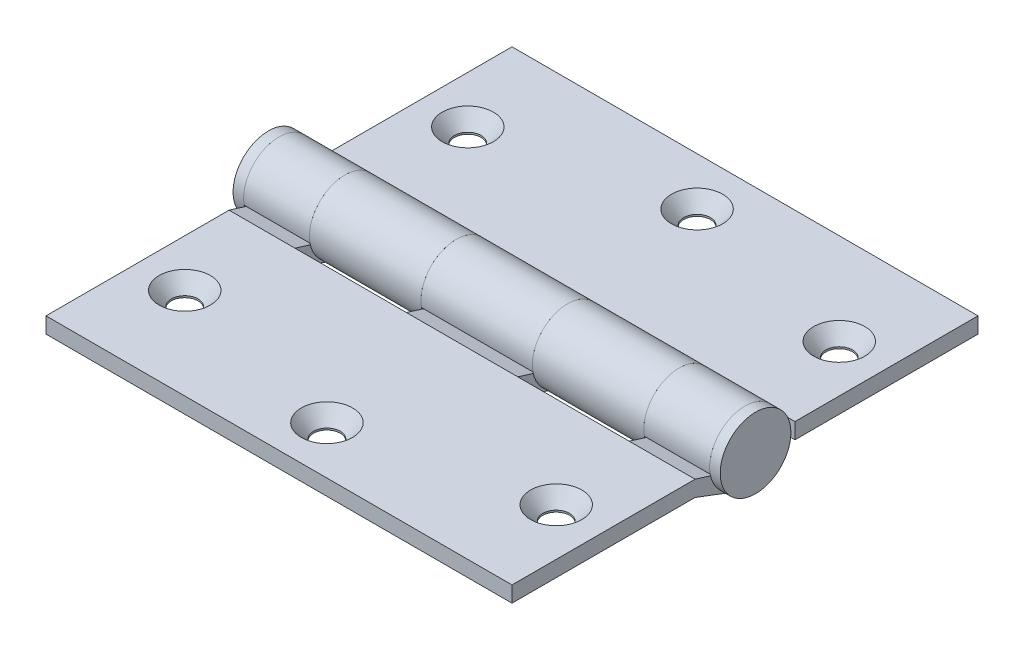
from build123d import *

# Parameters (mm, degrees)
LEFT_LEAF_DEPTH                              = 44.45
CUT_EXTRUDE1_DEPTH                           = 64.222822796
CUT_EXTRUDE1_DEPTH_BACK                      = 64.222822796
SKETCH2_W                                    = 21.2598
SKETCH2_H                                    = 16.271875
RIGHT_LEAF_DEPTH                             = 21.2598
EXTRUDE3_START                               = -44.45
SKETCH4_W                                    = 34.925
SKETCH4_H                                    = 3.0226
EXTRUDE3_DEPTH                               = 88.9
SKETCH6_W                                    = 88.9
SKETCH6_H                                    = 3.3734375
SKETCH7_W                                    = 2.015066667
SKETCH7_H                                    = 6.746875
CSK_FOR_10_FLAT_HEAD_MACHINE_SCREW1_AT_COUNT = 2
CSK_FOR_10_FLAT_HEAD_MACHINE_SCREW1_AT_PITCH = 54.0004
CSK_FOR_10_FLAT_HEAD_MACHINE_SCREW1_2_COUNT  = 2
CSK_FOR_10_FLAT_HEAD_MACHINE_SCREW1_2_PITCH  = 89.0956405
CSK_FOR_10_FLAT_HEAD_MACHINE_SCREW1_3_COUNT  = 2
CSK_FOR_10_FLAT_HEAD_MACHINE_SCREW1_3_PITCH  = 70.866
CSK_FOR_10_FLAT_HEAD_MACHINE_SCREW1_4_COUNT  = 2
CSK_FOR_10_FLAT_HEAD_MACHINE_SCREW1_4_PITCH  = 71.676774812
CSK_FOR_10_FLAT_HEAD_MACHINE_SCREW1_5_COUNT  = 2
CSK_FOR_10_FLAT_HEAD_MACHINE_SCREW1_5_PITCH  = 36.39345824


with BuildPart() as part:
    # Sketch1 → Left Leaf (new, symmetric)
    with BuildSketch(Plane(origin=(0, 0, 0), x_dir=(0, 0, -1), z_dir=(1, 0, 0))):
        with BuildLine():
            Line((-9.525, -3.6068), (-2.389867117, -6.309426078))
            ThreePointArc((-2.389867117, -6.309426078), (5.183454402, 4.318810338), (-6.637155431, -1.21181271))
            Line((-6.637155431, -1.21181271), (-2.148853245, -2.600482704))
            ThreePointArc((-2.148853245, -2.600482704), (1.603448449, 2.968001624), (-0.997099439, -3.222712099))
            Line((-0.997099439, -3.222712099), (-9.525, -0.5842))
            Line((-9.525, -0.5842), (-44.45, -0.5842))
            Line((-44.45, -0.5842), (-44.45, -3.6068))
            Line((-44.45, -3.6068), (-9.525, -3.6068))
        make_face()
    extrude(amount=LEFT_LEAF_DEPTH, both=True)

    # Sketch2 → Cut-Extrude1 (cut, two sides: drawn at the far end of the back side and taken through both)
    with BuildSketch(Plane(origin=(0, 0, 0), x_dir=(1, 0, 0), z_dir=(0, 1, 0)).offset(-CUT_EXTRUDE1_DEPTH_BACK)):
        with Locations((21.2598, -1.3890625)):
            Rectangle(SKETCH2_W, SKETCH2_H)
        with Locations((-21.2598, -1.3890625)):
            Rectangle(SKETCH2_W, SKETCH2_H)
    extrude(amount=CUT_EXTRUDE1_DEPTH + CUT_EXTRUDE1_DEPTH_BACK, mode=Mode.SUBTRACT)

    # Sketch9 → CSK for #10 Flat Head Machine Screw1 (revolve, cut)
    with BuildSketch(Plane(origin=(-35.433, -0.5842, 27.0002), x_dir=(0, 0, 1), z_dir=(1, 0, 0))):
        Polygon((0, 0), (0, 6.162675), (2.5527, 6.162675), (2.5527, 2.688180894), (4.8895, 0), align=None)
    csk_for_10_flat_head_machine_screw1 = revolve(axis=Axis((-35.433, 5.7658, 27.0002), (0, -1, 0)), mode=Mode.SUBTRACT)

    # CSK for _10 Flat Head Machine Screw1 3: CSK for #10 Flat Head Machine Screw1 ×2
    with Locations(*[(i * CSK_FOR_10_FLAT_HEAD_MACHINE_SCREW1_3_PITCH, 0, 0) for i in range(1, CSK_FOR_10_FLAT_HEAD_MACHINE_SCREW1_3_COUNT)]):
        add(csk_for_10_flat_head_machine_screw1, mode=Mode.SUBTRACT)

    # CSK for _10 Flat Head Machine Screw1 5: CSK for #10 Flat Head Machine Screw1 ×2
    with Locations(*[Vector(0.9736090416769398, 0, 0.22822233450061566) * (i * CSK_FOR_10_FLAT_HEAD_MACHINE_SCREW1_5_PITCH) for i in range(1, CSK_FOR_10_FLAT_HEAD_MACHINE_SCREW1_5_COUNT)]):
        add(csk_for_10_flat_head_machine_screw1, mode=Mode.SUBTRACT)


with BuildPart() as body_2:
    # Sketch3 → Right Leaf (new body)
    with BuildSketch(Plane(origin=(31.8897, 0, 0), x_dir=(0, 0, -1), z_dir=(1, 0, 0))):
        with BuildLine():
            Line((9.525, -3.6068), (2.389867117, -6.309426078))
            ThreePointArc((2.389867117, -6.309426078), (-5.183454402, 4.318810338), (6.637155431, -1.21181271))
            Line((6.637155431, -1.21181271), (2.148853245, -2.600482704))
            ThreePointArc((2.148853245, -2.600482704), (-1.603448449, 2.968001624), (0.997099439, -3.222712099))
            Line((0.997099439, -3.222712099), (9.525, -0.5842))
            Line((9.525, -0.5842), (44.45, -0.5842))
            Line((44.45, -0.5842), (44.45, -3.6068))
            Line((44.45, -3.6068), (9.525, -3.6068))
        make_face()
    extrude(amount=-RIGHT_LEAF_DEPTH)


with BuildPart() as body_3:
    # Mirror1: mirrored copy
    add(body_2.part.mirror(Plane(origin=(0, 0, 0), x_dir=(0, 0, 1), z_dir=(1, 0, 0))))


with BuildPart() as body_4:
    # Sketch4 → Extrude3 (new body)
    with BuildSketch(Plane.ZY.offset(EXTRUDE3_START)):
        with Locations((-26.9875, -2.0955)):
            Rectangle(SKETCH4_W, SKETCH4_H)
    extrude(amount=EXTRUDE3_DEPTH)


with BuildPart() as body_3_1:
    add(body_3.part)

    # Combine1: union body 2, body 4
    add(body_2.part)
    add(body_4.part)

    # CSK for #10 Flat Head Machine Screw1 at: CSK for #10 Flat Head Machine Screw1 ×2
    with Locations(*[(0, 0, -i * CSK_FOR_10_FLAT_HEAD_MACHINE_SCREW1_AT_PITCH) for i in range(1, CSK_FOR_10_FLAT_HEAD_MACHINE_SCREW1_AT_COUNT)]):
        add(csk_for_10_flat_head_machine_screw1, mode=Mode.SUBTRACT)

    # CSK for _10 Flat Head Machine Screw1 2: CSK for #10 Flat Head Machine Screw1 ×2
    with Locations(*[Vector(0.7953924524483952, 0, -0.6060947505036878) * (i * CSK_FOR_10_FLAT_HEAD_MACHINE_SCREW1_2_PITCH) for i in range(1, CSK_FOR_10_FLAT_HEAD_MACHINE_SCREW1_2_COUNT)]):
        add(csk_for_10_flat_head_machine_screw1, mode=Mode.SUBTRACT)

    # CSK for _10 Flat Head Machine Screw1 4: CSK for #10 Flat Head Machine Screw1 ×2
    with Locations(*[Vector(0.4943442292565722, 0, -0.8692662325206967) * (i * CSK_FOR_10_FLAT_HEAD_MACHINE_SCREW1_4_PITCH) for i in range(1, CSK_FOR_10_FLAT_HEAD_MACHINE_SCREW1_4_COUNT)]):
        add(csk_for_10_flat_head_machine_screw1, mode=Mode.SUBTRACT)


with BuildPart() as body_3_2:
    # Sketch6 → Pin (revolve)
    with BuildSketch(Plane(origin=(0, 0, 0), x_dir=(1, 0, 0), z_dir=(0, 1, 0)), mode=Mode.PRIVATE) as pin_sk:
        with Locations((0, -1.68671875)):
            Rectangle(SKETCH6_W, SKETCH6_H)
    revolve(pin_sk.sketch.rotate(Axis((24.566181471, 0, 0), (-1, 0, 0)), 180), axis=Axis((24.566181471, 0, 0), (-1, 0, 0)))

    # Sketch7 → Spun Pin (revolve)
    with BuildSketch(Plane(origin=(0, 0, 0), x_dir=(1, 0, 0), z_dir=(0, 1, 0)), mode=Mode.PRIVATE) as spun_pin_sk:
        with Locations((-45.457533334, -3.3734375)):
            Rectangle(SKETCH7_W, SKETCH7_H)
        with Locations((45.457533334, -3.3734375)):
            Rectangle(SKETCH7_W, SKETCH7_H)
    revolve(spun_pin_sk.sketch.rotate(Axis((24.566181471, 0, 0), (-1, 0, 0)), 180), axis=Axis((24.566181471, 0, 0), (-1, 0, 0)))


solid = Compound([part.part, body_3_1.part, body_3_2.part])
